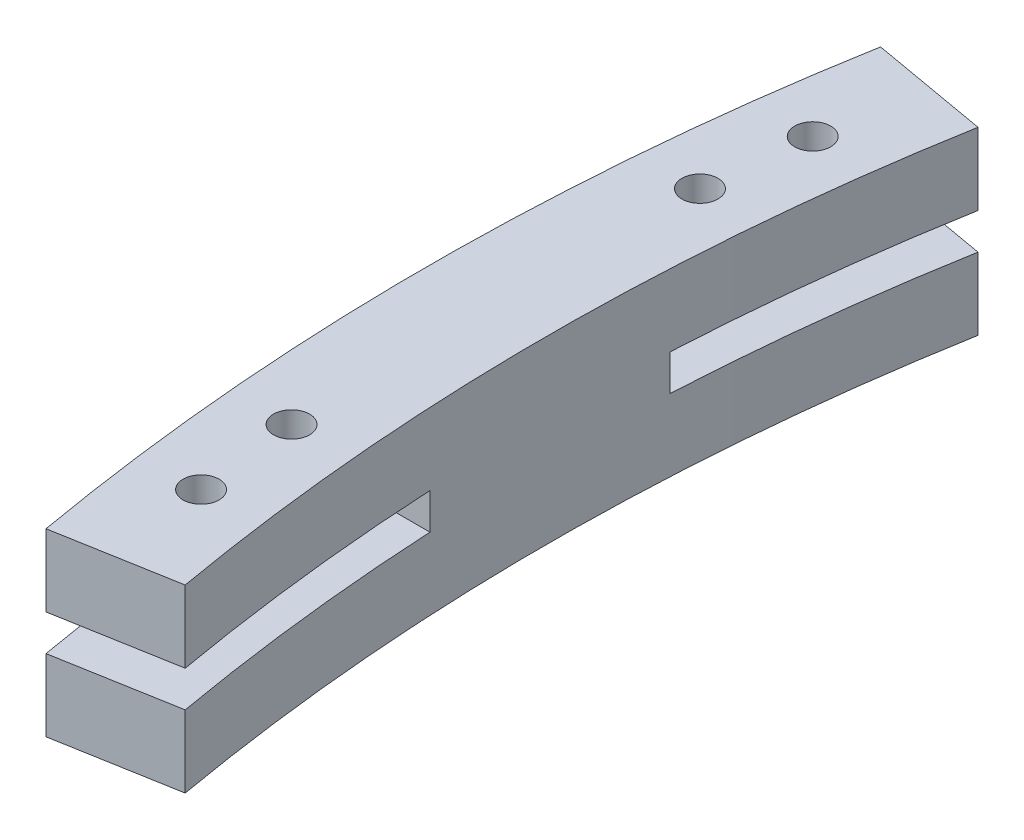
from build123d import *

# Parameters (mm, degrees)
BASE_DEPTH            = 7.5
MOUNT_START           = -1.5
MOUNT_DEPTH           = 3
MOUNT_HOLE_DEPTH      = 204.131478566
MOUNT_HOLE_DEPTH_BACK = 204.131478566
SKETCH12_R            = 1.5
SKETCH14_R            = 2
SHAFT_HOLE_DEPTH      = 37.394984425
SKETCH13_W            = 2.5
SKETCH13_H            = 3.5


with BuildPart() as part:
    # Sketch9 → base (new, symmetric)
    with BuildSketch(Plane(origin=(0, 0, 0), x_dir=(1, 0, 0), z_dir=(0, 1, 0))):
        with BuildLine():
            ThreePointArc((-187.113473072, -32.993153757), (-190, 0), (-187.113473072, 32.993153757))
            Line((-187.113473072, 32.993153757), (-196.961550602, 34.729635533))
            ThreePointArc((-196.961550602, 34.729635533), (-200, 0), (-196.961550602, -34.729635533))
            Line((-196.961550602, -34.729635533), (-187.113473072, -32.993153757))
        make_face()
    extrude(amount=BASE_DEPTH, both=True)

    # Sketch11 → mount (cut)
    with BuildSketch(Plane(origin=(0, 0, 0), x_dir=(1, 0, 0), z_dir=(0, 1, 0)).offset(MOUNT_START)):
        with BuildLine():
            Line((-189.73665961, -10), (-199.749843554, -10))
            ThreePointArc((-199.749843554, -10), (-198.7407137, -22.408228804), (-196.961550602, -34.729635533))
            Line((-196.961550602, -34.729635533), (-187.113473072, -32.993153757))
            ThreePointArc((-187.113473072, -32.993153757), (-188.775466906, -21.536552519), (-189.73665961, -10))
        make_face()
        with BuildLine():
            Line((-189.73665961, 10), (-199.749843554, 10))
            ThreePointArc((-199.749843554, 10), (-198.7407137, 22.408228804), (-196.961550602, 34.729635533))
            Line((-196.961550602, 34.729635533), (-187.113473072, 32.993153757))
            ThreePointArc((-187.113473072, 32.993153757), (-188.775466906, 21.536552519), (-189.73665961, 10))
        make_face()
    extrude(amount=MOUNT_DEPTH, mode=Mode.SUBTRACT)

    # Sketch12 → mount hole (cut, two sides: drawn at the far end of the back side and taken through both)
    with BuildSketch(Plane(origin=(0, 0, 0), x_dir=(1, 0, 0), z_dir=(0, 1, 0)).offset(-MOUNT_HOLE_DEPTH_BACK)):
        with Locations(Location((-193.331747968, 25.452607483, 0), (0, 0, 270))):
            Circle(SKETCH12_R)
        with Locations(Location((-194.257966128, 16.995369836, 0), (0, 0, 270))):
            Circle(SKETCH12_R)
        with Locations(Location((-194.257966128, -16.995369836, 0), (0, 0, 270))):
            Circle(SKETCH12_R)
        with Locations(Location((-193.331747968, -25.452607483, 0), (0, 0, 270))):
            Circle(SKETCH12_R)
    extrude(amount=MOUNT_HOLE_DEPTH + MOUNT_HOLE_DEPTH_BACK, mode=Mode.SUBTRACT)

    # Sketch14 → shaft hole (cut, through all)
    with BuildSketch(Plane.ZY.offset(195)):
        with Locations(Location((0, 0, 0), (0, 0, 90))):
            Circle(SKETCH14_R)
    extrude(amount=SHAFT_HOLE_DEPTH, mode=Mode.SUBTRACT)

    # Sketch13 → bearinghole (revolve, cut)
    with BuildSketch(Plane(origin=(0, 0, 0), x_dir=(1, 0, 0), z_dir=(0, 1, 0)), mode=Mode.PRIVATE) as bearinghole_sk:
        with Locations((-196.25, 1.75)):
            Rectangle(SKETCH13_W, SKETCH13_H)
    revolve(bearinghole_sk.sketch.rotate(Axis((0, 0, 0), (-1, 0, 0)), 270), axis=Axis((0, 0, 0), (-1, 0, 0)), mode=Mode.SUBTRACT)


solid = part.part
